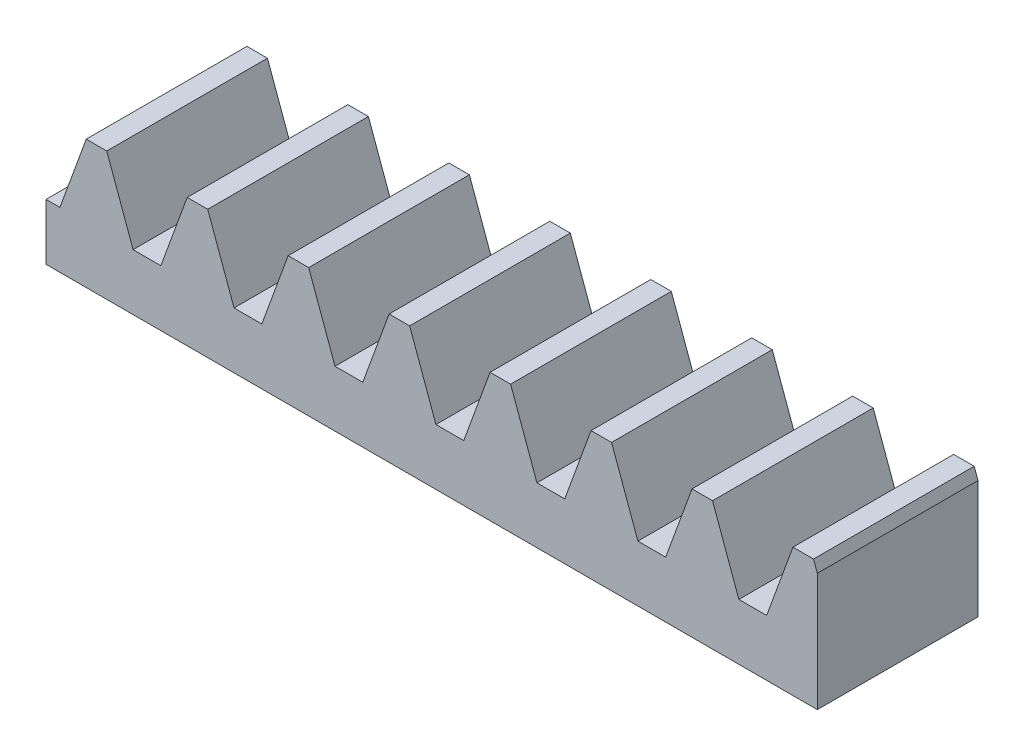
from build123d import *

# Parameters (mm, degrees)
BLANKSKE_W        = 304.8
BLANKSKE_H        = 50.8
BLANK_DEPTH       = 63.5
TOOTHCUTSIM_DEPTH = 316.461455649
TEETHCUTS_COUNT   = 9
TEETHCUTS_PITCH   = 39.898226655


with BuildPart() as part:
    # BlankSke → Blank (new body)
    with BuildSketch(Plane.XY):
        with Locations((152.4, 25.4)):
            Rectangle(BLANKSKE_W, BLANKSKE_H)
    extrude(amount=-BLANK_DEPTH)

    # TooCutSkeSim → ToothCutSim (cut, through all)
    with BuildSketch(Plane.XY):
        Polygon((5.491929195, 22.225), (-5.491929195, 22.225), (-15.901623483, 50.8254), (15.901623483, 50.8254), align=None)
    toothcutsim = extrude(amount=-TOOTHCUTSIM_DEPTH, mode=Mode.SUBTRACT)

    # TeethCuts: ToothCutSim ×9
    with Locations(*[(i * TEETHCUTS_PITCH, 0, 0) for i in range(1, TEETHCUTS_COUNT)]):
        add(toothcutsim, mode=Mode.SUBTRACT)


solid = part.part
